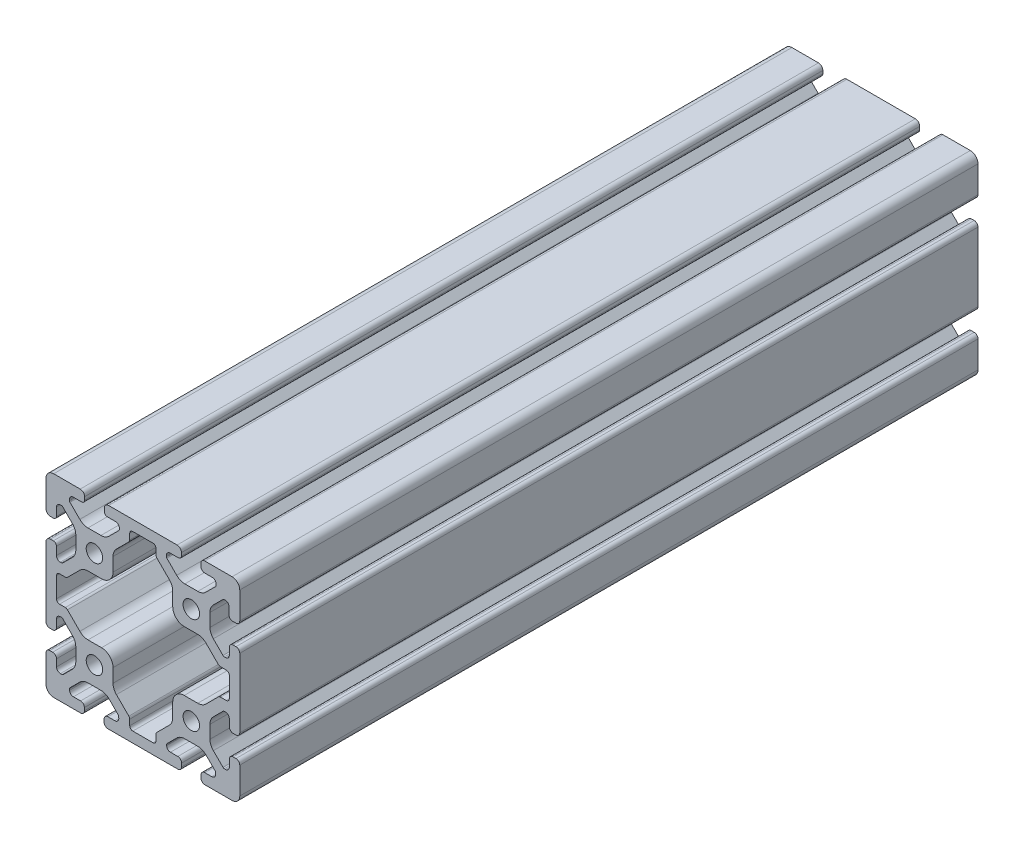
from build123d import *

# Parameters (mm, degrees)
SKETCH1_R      = 3.4
EXTRUDE1_DEPTH = 304.8


with BuildPart() as part:
    # Sketch1 → Extrude1 (new body)
    with BuildSketch(Plane.XY):
        with BuildLine():
            Line((29.091242789, 26.036541495), (33.082657296, 30.027956002))
            ThreePointArc((33.082657296, 30.027956002), (33.329219041, 30.192703293), (33.62005845, 30.250554848))
            Line((33.62005845, 30.250554848), (33.955571436, 30.250554848))
            ThreePointArc((33.955571436, 30.250554848), (35.065729082, 29.790712494), (35.525571436, 28.680554848))
            Line((35.525571436, 28.680554848), (35.525571436, 25.777866899))
            ThreePointArc((35.525571436, 25.777866899), (35.985413789, 24.667709253), (37.095571436, 24.207866899))
            Line((37.095571436, 24.207866899), (38.43, 24.207866899))
            ThreePointArc((38.43, 24.207866899), (39.540157646, 24.667709253), (40, 25.777866899))
            Line((40, 25.777866899), (40, 32.933852749))
            Line((40, 32.933852749), (40, 36.83))
            ThreePointArc((40, 36.83), (39.071528496, 39.071528496), (36.83, 40))
            Line((36.83, 40), (25.540851266, 40))
            ThreePointArc((25.540851266, 40), (24.43069362, 39.540157646), (23.970851266, 38.43))
            Line((23.970851266, 38.43), (23.970851266, 37.249043598))
            ThreePointArc((23.970851266, 37.249043598), (24.43069362, 36.138885952), (25.540851266, 35.679043598))
            Line((25.540851266, 35.679043598), (28.625762638, 35.679043598))
            ThreePointArc((28.625762638, 35.679043598), (29.77116849, 35.239363487), (30.250554848, 34.11))
            Line((30.250554848, 34.11), (30.250554848, 33.62005845))
            ThreePointArc((30.250554848, 33.62005845), (30.192703293, 33.329219041), (30.027956002, 33.082657296))
            Line((30.027956002, 33.082657296), (26.036541495, 29.091242789))
            ThreePointArc((26.036541495, 29.091242789), (24.495530588, 28.061572221), (22.677784284, 27.7))
            Line((22.677784284, 27.7), (17.322215716, 27.7))
            ThreePointArc((17.322215716, 27.7), (15.504469412, 28.061572221), (13.963458505, 29.091242789))
            Line((13.963458505, 29.091242789), (9.90393336, 33.150767934))
            ThreePointArc((9.90393336, 33.150767934), (9.764102181, 33.360040084), (9.715, 33.606893415))
            Line((9.715, 33.606893415), (9.715, 34.096834965))
            ThreePointArc((9.715, 34.096834965), (10.178698303, 35.216301697), (11.298165035, 35.68))
            Line((11.298165035, 35.68), (14.642754087, 35.68))
            ThreePointArc((14.642754087, 35.68), (15.560045469, 36.059954531), (15.94, 36.977245913))
            Line((15.94, 36.977245913), (15.94, 38.194841282))
            ThreePointArc((15.94, 38.194841282), (15.411281253, 39.471281253), (14.134841282, 40))
            Line((14.134841282, 40), (6.984433948, 40))
            Line((6.984433948, 40), (-6.984433948, 40))
            Line((-6.984433948, 40), (-14.134841282, 40))
            ThreePointArc((-14.134841282, 40), (-15.411281253, 39.471281253), (-15.94, 38.194841282))
            Line((-15.94, 38.194841282), (-15.94, 36.977245913))
            ThreePointArc((-15.94, 36.977245913), (-15.560045469, 36.059954531), (-14.642754087, 35.68))
            Line((-14.642754087, 35.68), (-11.298165035, 35.68))
            ThreePointArc((-11.298165035, 35.68), (-10.178698303, 35.216301697), (-9.715, 34.096834965))
            Line((-9.715, 34.096834965), (-9.715, 33.606893415))
            ThreePointArc((-9.715, 33.606893415), (-9.764102181, 33.360040084), (-9.90393336, 33.150767934))
            Line((-9.90393336, 33.150767934), (-13.963458505, 29.091242789))
            ThreePointArc((-13.963458505, 29.091242789), (-15.504469412, 28.061572221), (-17.322215716, 27.7))
            Line((-17.322215716, 27.7), (-22.677784284, 27.7))
            ThreePointArc((-22.677784284, 27.7), (-24.495530588, 28.061572221), (-26.036541495, 29.091242789))
            Line((-26.036541495, 29.091242789), (-30.09606664, 33.150767934))
            ThreePointArc((-30.09606664, 33.150767934), (-30.235897819, 33.360040084), (-30.285, 33.606893415))
            Line((-30.285, 33.606893415), (-30.285, 34.096834965))
            ThreePointArc((-30.285, 34.096834965), (-29.821301697, 35.216301697), (-28.701834965, 35.68))
            Line((-28.701834965, 35.68), (-25.357245913, 35.68))
            ThreePointArc((-25.357245913, 35.68), (-24.439954531, 36.059954531), (-24.06, 36.977245913))
            Line((-24.06, 36.977245913), (-24.06, 38.194841282))
            ThreePointArc((-24.06, 38.194841282), (-24.588718747, 39.471281253), (-25.865158718, 40))
            Line((-25.865158718, 40), (-33.031395847, 40))
            Line((-33.031395847, 40), (-36.83, 40))
            ThreePointArc((-36.83, 40), (-39.071528496, 39.071528496), (-40, 36.83))
            Line((-40, 36.83), (-40, 33.318079463))
            Line((-40, 33.318079463), (-40, 25.865158718))
            ThreePointArc((-40, 25.865158718), (-39.471281253, 24.588718747), (-38.194841282, 24.06))
            Line((-38.194841282, 24.06), (-36.977245913, 24.06))
            ThreePointArc((-36.977245913, 24.06), (-36.059954531, 24.439954531), (-35.68, 25.357245913))
            Line((-35.68, 25.357245913), (-35.68, 28.680554848))
            ThreePointArc((-35.68, 28.680554848), (-35.220157646, 29.790712494), (-34.11, 30.250554848))
            Line((-34.11, 30.250554848), (-33.62005845, 30.250554848))
            ThreePointArc((-33.62005845, 30.250554848), (-33.329219041, 30.192703293), (-33.082657296, 30.027956002))
            Line((-33.082657296, 30.027956002), (-29.091242789, 26.036541495))
            ThreePointArc((-29.091242789, 26.036541495), (-28.061572221, 24.495530588), (-27.7, 22.677784284))
            Line((-27.7, 22.677784284), (-27.7, 17.322215716))
            ThreePointArc((-27.7, 17.322215716), (-28.061572221, 15.504469412), (-29.091242789, 13.963458505))
            Line((-29.091242789, 13.963458505), (-33.082657296, 9.972043998))
            ThreePointArc((-33.082657296, 9.972043998), (-33.329219041, 9.807296707), (-33.62005845, 9.749445152))
            Line((-33.62005845, 9.749445152), (-34.11, 9.749445152))
            ThreePointArc((-34.11, 9.749445152), (-35.220157646, 10.209287506), (-35.68, 11.319445152))
            Line((-35.68, 11.319445152), (-35.68, 14.642754087))
            ThreePointArc((-35.68, 14.642754087), (-36.059954531, 15.560045469), (-36.977245913, 15.94))
            Line((-36.977245913, 15.94), (-38.194841282, 15.94))
            ThreePointArc((-38.194841282, 15.94), (-39.471281253, 15.411281253), (-40, 14.134841282))
            Line((-40, 14.134841282), (-40, 7.016888977))
            Line((-40, 7.016888977), (-40, -7.016888977))
            Line((-40, -7.016888977), (-40, -14.447338303))
            ThreePointArc((-40, -14.447338303), (-39.540157646, -15.557495949), (-38.43, -16.017338303))
            Line((-38.43, -16.017338303), (-37.25, -16.017338303))
            ThreePointArc((-37.25, -16.017338303), (-36.139842354, -15.557495949), (-35.68, -14.447338303))
            Line((-35.68, -14.447338303), (-35.68, -11.319445152))
            ThreePointArc((-35.68, -11.319445152), (-35.220157646, -10.209287506), (-34.11, -9.749445152))
            Line((-34.11, -9.749445152), (-33.62005845, -9.749445152))
            ThreePointArc((-33.62005845, -9.749445152), (-33.329219041, -9.807296707), (-33.082657296, -9.972043998))
            Line((-33.082657296, -9.972043998), (-29.091242789, -13.963458505))
            ThreePointArc((-29.091242789, -13.963458505), (-28.061572221, -15.504469412), (-27.7, -17.322215716))
            Line((-27.7, -17.322215716), (-27.7, -22.677784284))
            ThreePointArc((-27.7, -22.677784284), (-28.061572221, -24.495530588), (-29.091242789, -26.036541495))
            Line((-29.091242789, -26.036541495), (-32.871776968, -29.817075674))
            ThreePointArc((-32.871776968, -29.817075674), (-33.10612883, -29.976640176), (-33.382654504, -30.039211548))
            Line((-33.382654504, -30.039211548), (-34.05520779, -30.062697627))
            ThreePointArc((-34.05520779, -30.062697627), (-35.200613642, -29.623017515), (-35.68, -28.493654028))
            Line((-35.68, -28.493654028), (-35.68, -25.59096608))
            ThreePointArc((-35.68, -25.59096608), (-36.139842354, -24.480808433), (-37.25, -24.02096608))
            Line((-37.25, -24.02096608), (-38.43, -24.02096608))
            ThreePointArc((-38.43, -24.02096608), (-39.540157646, -24.480808433), (-40, -25.59096608))
            Line((-40, -25.59096608), (-40, -33.019082273))
            Line((-40, -33.019082273), (-40, -36.83))
            ThreePointArc((-40, -36.83), (-39.071528496, -39.071528496), (-36.83, -40))
            Line((-36.83, -40), (-33, -40))
            Line((-33, -40), (-25.72307469, -40))
            ThreePointArc((-25.72307469, -40), (-24.612917043, -39.540157646), (-24.15307469, -38.43))
            Line((-24.15307469, -38.43), (-24.15307469, -37.25))
            ThreePointArc((-24.15307469, -37.25), (-24.612917043, -36.139842354), (-25.72307469, -35.68))
            Line((-25.72307469, -35.68), (-28.680554848, -35.68))
            ThreePointArc((-28.680554848, -35.68), (-29.790712494, -35.220157646), (-30.250554848, -34.11))
            Line((-30.250554848, -34.11), (-30.250554848, -33.62005845))
            ThreePointArc((-30.250554848, -33.62005845), (-30.192703293, -33.329219041), (-30.027956002, -33.082657296))
            Line((-30.027956002, -33.082657296), (-26.036541495, -29.091242789))
            ThreePointArc((-26.036541495, -29.091242789), (-24.495530588, -28.061572221), (-22.677784284, -27.7))
            Line((-22.677784284, -27.7), (-17.322215716, -27.7))
            ThreePointArc((-17.322215716, -27.7), (-15.504469412, -28.061572221), (-13.963458505, -29.091242789))
            Line((-13.963458505, -29.091242789), (-10.203784275, -32.85091702))
            ThreePointArc((-10.203784275, -32.85091702), (-10.044219772, -33.085268882), (-9.9816484, -33.361794556))
            Line((-9.9816484, -33.361794556), (-9.957433876, -34.05520779))
            ThreePointArc((-9.957433876, -34.05520779), (-10.397113988, -35.200613642), (-11.526477474, -35.68))
            Line((-11.526477474, -35.68), (-14.429165423, -35.68))
            ThreePointArc((-14.429165423, -35.68), (-15.539323069, -36.139842354), (-15.999165423, -37.25))
            Line((-15.999165423, -37.25), (-15.999165423, -38.43))
            ThreePointArc((-15.999165423, -38.43), (-15.539323069, -39.540157646), (-14.429165423, -40))
            Line((-14.429165423, -40), (-6.998716097, -40))
            Line((-6.998716097, -40), (6.998716097, -40))
            Line((6.998716097, -40), (14.424638994, -40))
            ThreePointArc((14.424638994, -40), (15.53479664, -39.540157646), (15.994638994, -38.43))
            Line((15.994638994, -38.43), (15.994638994, -37.032644306))
            ThreePointArc((15.994638994, -37.032644306), (15.53479664, -35.922486659), (14.424638994, -35.462644306))
            Line((14.424638994, -35.462644306), (11.382372282, -35.462644306))
            ThreePointArc((11.382372282, -35.462644306), (10.272214636, -35.002801952), (9.812372282, -33.892644306))
            Line((9.812372282, -33.892644306), (9.812372282, -33.55713132))
            ThreePointArc((9.812372282, -33.55713132), (9.870223837, -33.266291912), (10.034971128, -33.019730166))
            Line((10.034971128, -33.019730166), (13.963458505, -29.091242789))
            ThreePointArc((13.963458505, -29.091242789), (15.504469412, -28.061572221), (17.322215716, -27.7))
            Line((17.322215716, -27.7), (22.677784284, -27.7))
            ThreePointArc((22.677784284, -27.7), (24.495530588, -28.061572221), (26.036541495, -29.091242789))
            Line((26.036541495, -29.091242789), (29.794925243, -32.849626538))
            ThreePointArc((29.794925243, -32.849626538), (29.954489746, -33.083978399), (30.017061118, -33.360504074))
            Line((30.017061118, -33.360504074), (30.041320706, -34.05520779))
            ThreePointArc((30.041320706, -34.05520779), (29.601640594, -35.200613642), (28.472277108, -35.68))
            Line((28.472277108, -35.68), (25.569589159, -35.68))
            ThreePointArc((25.569589159, -35.68), (24.459431513, -36.139842354), (23.999589159, -37.25))
            Line((23.999589159, -37.25), (23.999589159, -38.43))
            ThreePointArc((23.999589159, -38.43), (24.459431513, -39.540157646), (25.569589159, -40))
            Line((25.569589159, -40), (32.999849358, -40))
            Line((32.999849358, -40), (36.83, -40))
            ThreePointArc((36.83, -40), (39.071528496, -39.071528496), (40, -36.83))
            Line((40, -36.83), (40, -33.025941835))
            Line((40, -33.025941835), (40, -25.777866899))
            ThreePointArc((40, -25.777866899), (39.540157646, -24.667709253), (38.43, -24.207866899))
            Line((38.43, -24.207866899), (37.25, -24.207866899))
            ThreePointArc((37.25, -24.207866899), (36.139842354, -24.667709253), (35.68, -25.777866899))
            Line((35.68, -25.777866899), (35.68, -28.680554848))
            ThreePointArc((35.68, -28.680554848), (35.220157646, -29.790712494), (34.11, -30.250554848))
            Line((34.11, -30.250554848), (33.62005845, -30.250554848))
            ThreePointArc((33.62005845, -30.250554848), (33.329219041, -30.192703293), (33.082657296, -30.027956002))
            Line((33.082657296, -30.027956002), (29.091242789, -26.036541495))
            ThreePointArc((29.091242789, -26.036541495), (28.061572221, -24.495530588), (27.7, -22.677784284))
            Line((27.7, -22.677784284), (27.7, -17.322215716))
            ThreePointArc((27.7, -17.322215716), (28.061572221, -15.504469412), (29.091242789, -13.963458505))
            Line((29.091242789, -13.963458505), (33.082657296, -9.972043998))
            ThreePointArc((33.082657296, -9.972043998), (33.329219041, -9.807296707), (33.62005845, -9.749445152))
            Line((33.62005845, -9.749445152), (34.11, -9.749445152))
            ThreePointArc((34.11, -9.749445152), (35.220157646, -10.209287506), (35.68, -11.319445152))
            Line((35.68, -11.319445152), (35.68, -14.222133101))
            ThreePointArc((35.68, -14.222133101), (36.139842354, -15.332290747), (37.25, -15.792133101))
            Line((37.25, -15.792133101), (38.43, -15.792133101))
            ThreePointArc((38.43, -15.792133101), (39.540157646, -15.332290747), (40, -14.222133101))
            Line((40, -14.222133101), (40, -7.021415406))
            Line((40, -7.021415406), (40, 7.021415406))
            Line((40, 7.021415406), (40, 14.222133101))
            ThreePointArc((40, 14.222133101), (39.540157646, 15.332290747), (38.43, 15.792133101))
            Line((38.43, 15.792133101), (37.25, 15.792133101))
            ThreePointArc((37.25, 15.792133101), (36.139842354, 15.332290747), (35.68, 14.222133101))
            Line((35.68, 14.222133101), (35.68, 11.319445152))
            ThreePointArc((35.68, 11.319445152), (35.220157646, 10.209287506), (34.11, 9.749445152))
            Line((34.11, 9.749445152), (33.62005845, 9.749445152))
            ThreePointArc((33.62005845, 9.749445152), (33.329219041, 9.807296707), (33.082657296, 9.972043998))
            Line((33.082657296, 9.972043998), (29.091242789, 13.963458505))
            ThreePointArc((29.091242789, 13.963458505), (28.061572221, 15.504469412), (27.7, 17.322215716))
            Line((27.7, 17.322215716), (27.7, 22.677784284))
            ThreePointArc((27.7, 22.677784284), (28.061572221, 24.495530588), (29.091242789, 26.036541495))
        make_face()
        with Locations((-20, 20)):
            Circle(SKETCH1_R, mode=Mode.SUBTRACT)
        with Locations((20, 20)):
            Circle(SKETCH1_R, mode=Mode.SUBTRACT)
        with Locations((20, -20)):
            Circle(SKETCH1_R, mode=Mode.SUBTRACT)
        with Locations((-20, -20)):
            Circle(SKETCH1_R, mode=Mode.SUBTRACT)
        with BuildLine():
            Line((17.07, 12.32), (22.657784284, 12.32))
            ThreePointArc((22.657784284, 12.32), (24.475530588, 11.958427779), (26.016541495, 10.928757211))
            Line((26.016541495, 10.928757211), (31.143879165, 5.80141954))
            ThreePointArc((31.143879165, 5.80141954), (31.555896818, 5.526118146), (32.041904777, 5.429445152))
            Line((32.041904777, 5.429445152), (34.41, 5.429445152))
            ThreePointArc((34.41, 5.429445152), (35.308025612, 5.057470764), (35.68, 4.159445152))
            Line((35.68, 4.159445152), (35.68, -4.159445152))
            ThreePointArc((35.68, -4.159445152), (35.308025612, -5.057470764), (34.41, -5.429445152))
            Line((34.41, -5.429445152), (32.041904777, -5.429445152))
            ThreePointArc((32.041904777, -5.429445152), (31.555896818, -5.526118146), (31.143879165, -5.80141954))
            Line((31.143879165, -5.80141954), (26.016541495, -10.928757211))
            ThreePointArc((26.016541495, -10.928757211), (24.475530588, -11.958427779), (22.657784284, -12.32))
            Line((22.657784284, -12.32), (17.07, -12.32))
            ThreePointArc((17.07, -12.32), (13.711242789, -13.711242789), (12.32, -17.07))
            Line((12.32, -17.07), (12.32, -22.657784284))
            ThreePointArc((12.32, -22.657784284), (11.958427779, -24.475530588), (10.928757211, -26.016541495))
            Line((10.928757211, -26.016541495), (5.80141954, -31.143879165))
            ThreePointArc((5.80141954, -31.143879165), (5.526118146, -31.555896818), (5.429445152, -32.041904777))
            Line((5.429445152, -32.041904777), (5.429445152, -34.41))
            ThreePointArc((5.429445152, -34.41), (5.057470764, -35.308025612), (4.159445152, -35.68))
            Line((4.159445152, -35.68), (-4.159445152, -35.68))
            ThreePointArc((-4.159445152, -35.68), (-5.057470764, -35.308025612), (-5.429445152, -34.41))
            Line((-5.429445152, -34.41), (-5.429445152, -32.041904777))
            ThreePointArc((-5.429445152, -32.041904777), (-5.526118146, -31.555896818), (-5.80141954, -31.143879165))
            Line((-5.80141954, -31.143879165), (-10.928757211, -26.016541495))
            ThreePointArc((-10.928757211, -26.016541495), (-11.958427779, -24.475530588), (-12.32, -22.657784284))
            Line((-12.32, -22.657784284), (-12.32, -17.07))
            ThreePointArc((-12.32, -17.07), (-13.711242789, -13.711242789), (-17.07, -12.32))
            Line((-17.07, -12.32), (-22.657784284, -12.32))
            ThreePointArc((-22.657784284, -12.32), (-24.475530588, -11.958427779), (-26.016541495, -10.928757211))
            Line((-26.016541495, -10.928757211), (-31.143879165, -5.80141954))
            ThreePointArc((-31.143879165, -5.80141954), (-31.555896818, -5.526118146), (-32.041904777, -5.429445152))
            Line((-32.041904777, -5.429445152), (-34.41, -5.429445152))
            ThreePointArc((-34.41, -5.429445152), (-35.308025612, -5.057470764), (-35.68, -4.159445152))
            Line((-35.68, -4.159445152), (-35.68, 4.159445152))
            ThreePointArc((-35.68, 4.159445152), (-35.308025612, 5.057470764), (-34.41, 5.429445152))
            Line((-34.41, 5.429445152), (-32.041904777, 5.429445152))
            ThreePointArc((-32.041904777, 5.429445152), (-31.555896818, 5.526118146), (-31.143879165, 5.80141954))
            Line((-31.143879165, 5.80141954), (-26.016541495, 10.928757211))
            ThreePointArc((-26.016541495, 10.928757211), (-24.475530588, 11.958427779), (-22.657784284, 12.32))
            Line((-22.657784284, 12.32), (-17.07, 12.32))
            ThreePointArc((-17.07, 12.32), (-13.711242789, 13.711242789), (-12.32, 17.07))
            Line((-12.32, 17.07), (-12.32, 22.657784284))
            ThreePointArc((-12.32, 22.657784284), (-11.958427779, 24.475530588), (-10.928757211, 26.016541495))
            Line((-10.928757211, 26.016541495), (-5.80141954, 31.143879165))
            ThreePointArc((-5.80141954, 31.143879165), (-5.526118146, 31.555896818), (-5.429445152, 32.041904777))
            Line((-5.429445152, 32.041904777), (-5.429445152, 34.41))
            ThreePointArc((-5.429445152, 34.41), (-5.057470764, 35.308025612), (-4.159445152, 35.68))
            Line((-4.159445152, 35.68), (4.159445152, 35.68))
            ThreePointArc((4.159445152, 35.68), (5.057470764, 35.308025612), (5.429445152, 34.41))
            Line((5.429445152, 34.41), (5.429445152, 32.041904777))
            ThreePointArc((5.429445152, 32.041904777), (5.526118146, 31.555896818), (5.80141954, 31.143879165))
            Line((5.80141954, 31.143879165), (10.928757211, 26.016541495))
            ThreePointArc((10.928757211, 26.016541495), (11.958427779, 24.475530588), (12.32, 22.657784284))
            Line((12.32, 22.657784284), (12.32, 17.07))
            ThreePointArc((12.32, 17.07), (13.711242789, 13.711242789), (17.07, 12.32))
        make_face(mode=Mode.SUBTRACT)
    extrude(amount=-EXTRUDE1_DEPTH)


solid = part.part
